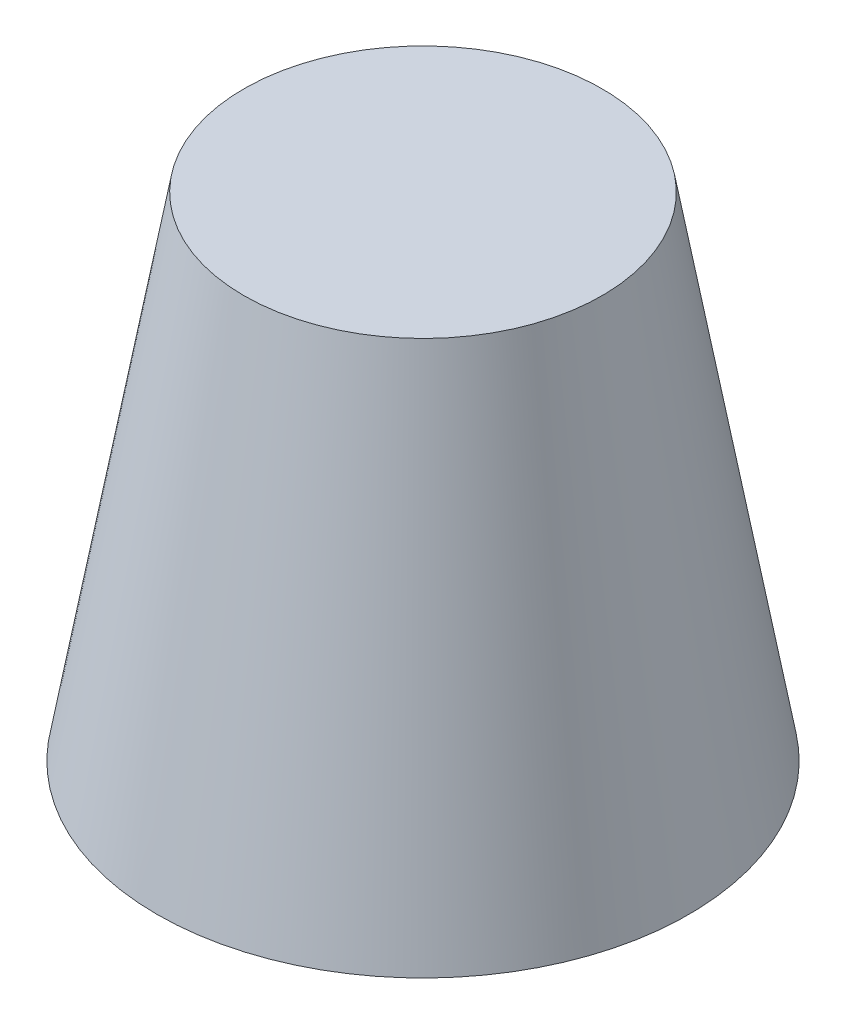
from build123d import *

# Parameters (mm, degrees)
SHELL1_T = -2.54


with BuildPart() as part:
    # Sketch1 → Revolve1 (revolve)
    with BuildSketch(Plane.XY, mode=Mode.PRIVATE) as revolve1_sk:
        Polygon((0, 0), (37.041666667, 0), (24.94916233, 68.58), (0, 68.58), align=None)
    revolve(revolve1_sk.sketch.rotate(Axis((0, 68.58, 0), (0, -1, 0)), 90), axis=Axis((0, 68.58, 0), (0, -1, 0)))

    # Shell1
    shell1_openings = [part.faces().sort_by_distance(p)[0] for p in [
        (0, 0, 0),
    ]]
    offset(amount=SHELL1_T, openings=shell1_openings, kind=Kind.INTERSECTION)


solid = part.part
